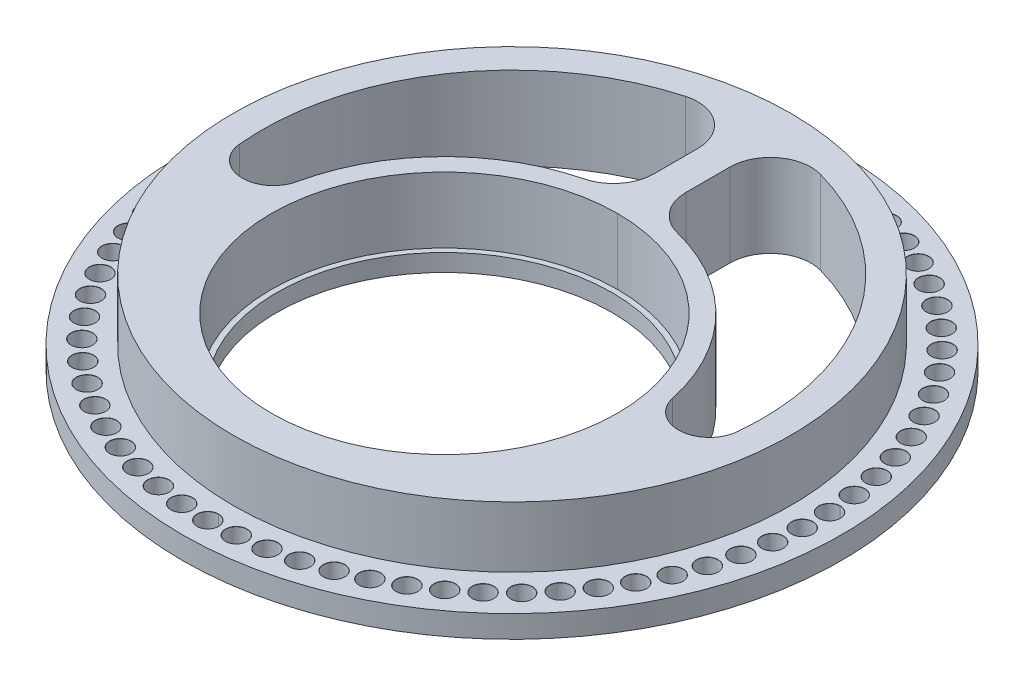
from build123d import *

# Parameters (mm, degrees)
SKETCH1_R                  = 61.9125
SKETCH1_R_2                = 30.988
SLOTTED_BODY_EXTRUDE_DEPTH = 4.191
SKETCH5_R                  = 52.3875
BOSS_EXTRUDE3_DEPTH        = 11.43
SKETCH6_R                  = 32.512
CUT_EXTRUDE5_DEPTH         = 89.94004134
SKETCH8_R                  = 32.512
SKETCH8_R_2                = 31.496
BOSS_EXTRUDE4_DEPTH        = 3.255000094
CIRPATTERN1_COUNT          = 70


with BuildPart() as part:
    # Sketch1 → Slotted-Body Extrude (new body)
    with BuildSketch(Plane(origin=(0, 0, 0), x_dir=(1, 0, 0), z_dir=(0, 1, 0))):
        with Locations(Location((0, 0, 0), (0, 0, 270))):
            Circle(SKETCH1_R)
        with Locations(Location((0, -12.7, 0), (0, 0, 270))):
            Circle(SKETCH1_R_2, mode=Mode.SUBTRACT)
    extrude(amount=SLOTTED_BODY_EXTRUDE_DEPTH)

    # Sketch5 → Boss-Extrude3 (add)
    with BuildSketch(Plane(origin=(0, 4.191, 0), x_dir=(1, 0, 0), z_dir=(0, 1, 0))):
        with Locations(Location((0, 0, 0), (0, 0, 270))):
            Circle(SKETCH5_R)
    extrude(amount=BOSS_EXTRUDE3_DEPTH)

    # Sketch6 → Cut-Extrude5 (cut, through all)
    with BuildSketch(Plane.XZ):
        with Locations(Location((0, 12.7, 0), (0, 0, 270))):
            Circle(SKETCH6_R)
        with BuildLine():
            Line((3.013951015, -37.906674687), (3.013951015, -29.674053734))
            ThreePointArc((3.013951015, -29.674053734), (4.62572071, -24.987309811), (8.779192117, -22.283230408))
            ThreePointArc((8.779192117, -22.283230408), (25.925135322, -12.375645206), (35.256203169, 5.09074497))
            ThreePointArc((35.256203169, 5.09074497), (41.313127715, 9.689980346), (46.782976949, 4.406037654))
            ThreePointArc((46.782976949, 4.406037654), (38.737451576, -26.59830719), (12.692135082, -45.243450433))
            ThreePointArc((12.692135082, -45.243450433), (6.03063496, -43.979061474), (3.013951015, -37.906674687))
        make_face()
        with BuildLine():
            Line((-3.013951015, -37.906674687), (-3.013951015, -29.674053734))
            ThreePointArc((-3.013951015, -29.674053734), (-4.62572071, -24.987309811), (-8.779192117, -22.283230408))
            ThreePointArc((-8.779192117, -22.283230408), (-25.925135322, -12.375645206), (-35.256203169, 5.09074497))
            ThreePointArc((-35.256203169, 5.09074497), (-41.313127715, 9.689980346), (-46.782976949, 4.406037654))
            ThreePointArc((-46.782976949, 4.406037654), (-38.737451576, -26.59830719), (-12.692135082, -45.243450433))
            ThreePointArc((-12.692135082, -45.243450433), (-6.03063496, -43.979061474), (-3.013951015, -37.906674687))
        make_face()
    extrude(amount=-CUT_EXTRUDE5_DEPTH, mode=Mode.SUBTRACT)

    # Sketch10 → Ø4.0mm Dowel Hole2 (revolve, cut)
    with BuildSketch(Plane(origin=(0, 4.191, -57.15), x_dir=(0, 0, 1), z_dir=(1, 0, 0))):
        Polygon((0, 0), (0, 4.191), (2, 4.191), (2, 0.025), (2.025, 0), align=None)
    f_4_0mm_dowel_hole2 = revolve(axis=Axis((0, 10.541, -57.15), (0, -1, 0)), mode=Mode.SUBTRACT)

    # CirPattern1: Ø4.0mm Dowel Hole2 ×70 about axis
    cirpattern1_axis = Axis((0, 0, 0), (0, 1, 0))
    for i in range(1, CIRPATTERN1_COUNT):
        add(f_4_0mm_dowel_hole2.rotate(cirpattern1_axis, i * 360 / CIRPATTERN1_COUNT), mode=Mode.SUBTRACT)


with BuildPart() as body_2:
    # Sketch8 → Boss-Extrude4 (new body)
    with BuildSketch(Plane.XZ):
        with Locations(Location((0, 12.7, 0), (0, 0, 270))):
            Circle(SKETCH8_R)
        with Locations(Location((0, 12.7, 0), (0, 0, 270))):
            Circle(SKETCH8_R_2, mode=Mode.SUBTRACT)
    extrude(amount=-BOSS_EXTRUDE4_DEPTH)


solid = Compound([part.part, body_2.part])
